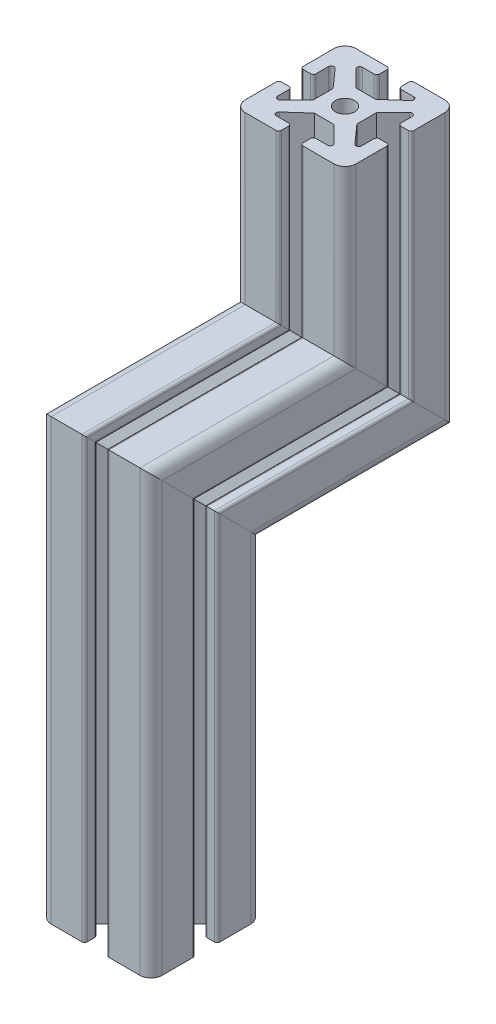
from build123d import *

# Parameters (mm, degrees)
SKETCH1_R                       = 3.492543695
F_001_40_40_EXTRUSION_1_DEPTH   = 109.284271247
SKETCH1_ON_SEGMENT_2_R          = 3.492543695
F_001_40_40_EXTRUSION_1_2_DEPTH = 128.568542495
SKETCH1_ON_SEGMENT_3_R          = 3.492543695
F_001_40_40_EXTRUSION_1_3_DEPTH = 167.884271247


with BuildPart() as part:
    # Sketch1 → 001 40-40_EXTRUSION(1) (new body)
    with BuildSketch(Plane(origin=(0, 0, 0), x_dir=(0, 0, -1), z_dir=(0, -1, 0))):
        with BuildLine():
            Line((-0.51168083, 7.684671829), (3.749889801, 7.684671829))
            Line((3.749889801, 7.684671829), (9.699681879, 13.624984685))
            ThreePointArc((9.699681879, 13.624984685), (9.917171057, 14.714970099), (8.993139054, 15.332654972))
            Line((8.993139054, 15.332654972), (4.845630957, 15.332654972))
            ThreePointArc((4.845630957, 15.332654972), (4.138524175, 15.625548191), (3.845630957, 16.332654972))
            Line((3.845630957, 16.332654972), (3.845630957, 19))
            ThreePointArc((3.845630957, 19), (4.138524175, 19.707106781), (4.845630957, 20))
            Line((4.845630957, 20), (16, 20))
            ThreePointArc((16, 20), (18.828427125, 18.828427125), (20, 16))
            Line((20, 16), (20, 4.961087436))
            ThreePointArc((20, 4.961087436), (19.707106781, 4.253980655), (19, 3.961087436))
            Line((19, 3.961087436), (16.388269628, 3.961087436))
            ThreePointArc((16.388269628, 3.961087436), (15.681162846, 4.253980655), (15.388269628, 4.961087436))
            Line((15.388269628, 4.961087436), (15.388269628, 9.408620307))
            ThreePointArc((15.388269628, 9.408620307), (14.744223919, 10.343123673), (13.641676542, 10.073901274))
            Line((13.641676542, 10.073901274), (7.684671829, 3.388818206))
            Line((7.684671829, 3.388818206), (7.684671829, 0.51168083))
            Line((7.684671829, 0.51168083), (7.684671829, -3.749889801))
            Line((7.684671829, -3.749889801), (13.624984685, -9.699681879))
            ThreePointArc((13.624984685, -9.699681879), (14.714970099, -9.917171057), (15.332654972, -8.993139054))
            Line((15.332654972, -8.993139054), (15.332654972, -4.845630957))
            ThreePointArc((15.332654972, -4.845630957), (15.625548191, -4.138524175), (16.332654972, -3.845630957))
            Line((16.332654972, -3.845630957), (19, -3.845630957))
            ThreePointArc((19, -3.845630957), (19.707106781, -4.138524175), (20, -4.845630957))
            Line((20, -4.845630957), (20, -16))
            ThreePointArc((20, -16), (18.828427125, -18.828427125), (16, -20))
            Line((16, -20), (4.961087436, -20))
            ThreePointArc((4.961087436, -20), (4.253980655, -19.707106781), (3.961087436, -19))
            Line((3.961087436, -19), (3.961087436, -16.388269628))
            ThreePointArc((3.961087436, -16.388269628), (4.253980655, -15.681162846), (4.961087436, -15.388269628))
            Line((4.961087436, -15.388269628), (9.408620307, -15.388269628))
            ThreePointArc((9.408620307, -15.388269628), (10.343123673, -14.744223919), (10.073901274, -13.641676542))
            Line((10.073901274, -13.641676542), (3.388818206, -7.684671829))
            Line((3.388818206, -7.684671829), (0.51168083, -7.684671829))
            Line((0.51168083, -7.684671829), (-3.749889801, -7.684671829))
            Line((-3.749889801, -7.684671829), (-9.699681879, -13.624984685))
            ThreePointArc((-9.699681879, -13.624984685), (-9.917171057, -14.714970099), (-8.993139054, -15.332654972))
            Line((-8.993139054, -15.332654972), (-4.845630957, -15.332654972))
            ThreePointArc((-4.845630957, -15.332654972), (-4.138524175, -15.625548191), (-3.845630957, -16.332654972))
            Line((-3.845630957, -16.332654972), (-3.845630957, -19))
            ThreePointArc((-3.845630957, -19), (-4.138524175, -19.707106781), (-4.845630957, -20))
            Line((-4.845630957, -20), (-16, -20))
            ThreePointArc((-16, -20), (-18.828427125, -18.828427125), (-20, -16))
            Line((-20, -16), (-20, -4.961087436))
            ThreePointArc((-20, -4.961087436), (-19.707106781, -4.253980655), (-19, -3.961087436))
            Line((-19, -3.961087436), (-16.388269628, -3.961087436))
            ThreePointArc((-16.388269628, -3.961087436), (-15.681162846, -4.253980655), (-15.388269628, -4.961087436))
            Line((-15.388269628, -4.961087436), (-15.388269628, -9.408620307))
            ThreePointArc((-15.388269628, -9.408620307), (-14.744223919, -10.343123673), (-13.641676542, -10.073901274))
            Line((-13.641676542, -10.073901274), (-7.684671829, -3.388818206))
            Line((-7.684671829, -3.388818206), (-7.684671829, -0.51168083))
            Line((-7.684671829, -0.51168083), (-7.684671829, 3.749889801))
            Line((-7.684671829, 3.749889801), (-13.624984685, 9.699681879))
            ThreePointArc((-13.624984685, 9.699681879), (-14.714970099, 9.917171057), (-15.332654972, 8.993139054))
            Line((-15.332654972, 8.993139054), (-15.332654972, 4.845630957))
            ThreePointArc((-15.332654972, 4.845630957), (-15.625548191, 4.138524175), (-16.332654972, 3.845630957))
            Line((-16.332654972, 3.845630957), (-19, 3.845630957))
            ThreePointArc((-19, 3.845630957), (-19.707106781, 4.138524175), (-20, 4.845630957))
            Line((-20, 4.845630957), (-20, 16))
            ThreePointArc((-20, 16), (-18.828427125, 18.828427125), (-16, 20))
            Line((-16, 20), (-4.961087436, 20))
            ThreePointArc((-4.961087436, 20), (-4.253980655, 19.707106781), (-3.961087436, 19))
            Line((-3.961087436, 19), (-3.961087436, 16.388269628))
            ThreePointArc((-3.961087436, 16.388269628), (-4.253980655, 15.681162846), (-4.961087436, 15.388269628))
            Line((-4.961087436, 15.388269628), (-9.408620307, 15.388269628))
            ThreePointArc((-9.408620307, 15.388269628), (-10.343123673, 14.744223919), (-10.073901274, 13.641676542))
            Line((-10.073901274, 13.641676542), (-3.388818206, 7.684671829))
            Line((-3.388818206, 7.684671829), (-0.51168083, 7.684671829))
        make_face()
        Circle(SKETCH1_R, mode=Mode.SUBTRACT)
    extrude(amount=F_001_40_40_EXTRUSION_1_DEPTH)

    # 001 40-40_EXTRUSION(1) mitre 1
    split(bisect_by=Plane(origin=(0, -80, 0), x_dir=(-1, 0, 0), z_dir=(0, 0.707106781, -0.707106781)), keep=Keep.TOP)


with BuildPart() as body_2:
    # Sketch1 on segment 2 (carried to segment 2) → 001 40-40_EXTRUSION_1 2 (new body)
    with BuildSketch(Plane(origin=(0, -80, -29.284271247), x_dir=(0, -1, 0), z_dir=(0, 0, 1))):
        with BuildLine():
            Line((-0.51168083, 7.684671829), (3.749889801, 7.684671829))
            Line((3.749889801, 7.684671829), (9.699681879, 13.624984685))
            ThreePointArc((9.699681879, 13.624984685), (9.917171057, 14.714970099), (8.993139054, 15.332654972))
            Line((8.993139054, 15.332654972), (4.845630957, 15.332654972))
            ThreePointArc((4.845630957, 15.332654972), (4.138524175, 15.625548191), (3.845630957, 16.332654972))
            Line((3.845630957, 16.332654972), (3.845630957, 19))
            ThreePointArc((3.845630957, 19), (4.138524175, 19.707106781), (4.845630957, 20))
            Line((4.845630957, 20), (16, 20))
            ThreePointArc((16, 20), (18.828427125, 18.828427125), (20, 16))
            Line((20, 16), (20, 4.961087436))
            ThreePointArc((20, 4.961087436), (19.707106781, 4.253980655), (19, 3.961087436))
            Line((19, 3.961087436), (16.388269628, 3.961087436))
            ThreePointArc((16.388269628, 3.961087436), (15.681162846, 4.253980655), (15.388269628, 4.961087436))
            Line((15.388269628, 4.961087436), (15.388269628, 9.408620307))
            ThreePointArc((15.388269628, 9.408620307), (14.744223919, 10.343123673), (13.641676542, 10.073901274))
            Line((13.641676542, 10.073901274), (7.684671829, 3.388818206))
            Line((7.684671829, 3.388818206), (7.684671829, 0.51168083))
            Line((7.684671829, 0.51168083), (7.684671829, -3.749889801))
            Line((7.684671829, -3.749889801), (13.624984685, -9.699681879))
            ThreePointArc((13.624984685, -9.699681879), (14.714970099, -9.917171057), (15.332654972, -8.993139054))
            Line((15.332654972, -8.993139054), (15.332654972, -4.845630957))
            ThreePointArc((15.332654972, -4.845630957), (15.625548191, -4.138524175), (16.332654972, -3.845630957))
            Line((16.332654972, -3.845630957), (19, -3.845630957))
            ThreePointArc((19, -3.845630957), (19.707106781, -4.138524175), (20, -4.845630957))
            Line((20, -4.845630957), (20, -16))
            ThreePointArc((20, -16), (18.828427125, -18.828427125), (16, -20))
            Line((16, -20), (4.961087436, -20))
            ThreePointArc((4.961087436, -20), (4.253980655, -19.707106781), (3.961087436, -19))
            Line((3.961087436, -19), (3.961087436, -16.388269628))
            ThreePointArc((3.961087436, -16.388269628), (4.253980655, -15.681162846), (4.961087436, -15.388269628))
            Line((4.961087436, -15.388269628), (9.408620307, -15.388269628))
            ThreePointArc((9.408620307, -15.388269628), (10.343123673, -14.744223919), (10.073901274, -13.641676542))
            Line((10.073901274, -13.641676542), (3.388818206, -7.684671829))
            Line((3.388818206, -7.684671829), (0.51168083, -7.684671829))
            Line((0.51168083, -7.684671829), (-3.749889801, -7.684671829))
            Line((-3.749889801, -7.684671829), (-9.699681879, -13.624984685))
            ThreePointArc((-9.699681879, -13.624984685), (-9.917171057, -14.714970099), (-8.993139054, -15.332654972))
            Line((-8.993139054, -15.332654972), (-4.845630957, -15.332654972))
            ThreePointArc((-4.845630957, -15.332654972), (-4.138524175, -15.625548191), (-3.845630957, -16.332654972))
            Line((-3.845630957, -16.332654972), (-3.845630957, -19))
            ThreePointArc((-3.845630957, -19), (-4.138524175, -19.707106781), (-4.845630957, -20))
            Line((-4.845630957, -20), (-16, -20))
            ThreePointArc((-16, -20), (-18.828427125, -18.828427125), (-20, -16))
            Line((-20, -16), (-20, -4.961087436))
            ThreePointArc((-20, -4.961087436), (-19.707106781, -4.253980655), (-19, -3.961087436))
            Line((-19, -3.961087436), (-16.388269628, -3.961087436))
            ThreePointArc((-16.388269628, -3.961087436), (-15.681162846, -4.253980655), (-15.388269628, -4.961087436))
            Line((-15.388269628, -4.961087436), (-15.388269628, -9.408620307))
            ThreePointArc((-15.388269628, -9.408620307), (-14.744223919, -10.343123673), (-13.641676542, -10.073901274))
            Line((-13.641676542, -10.073901274), (-7.684671829, -3.388818206))
            Line((-7.684671829, -3.388818206), (-7.684671829, -0.51168083))
            Line((-7.684671829, -0.51168083), (-7.684671829, 3.749889801))
            Line((-7.684671829, 3.749889801), (-13.624984685, 9.699681879))
            ThreePointArc((-13.624984685, 9.699681879), (-14.714970099, 9.917171057), (-15.332654972, 8.993139054))
            Line((-15.332654972, 8.993139054), (-15.332654972, 4.845630957))
            ThreePointArc((-15.332654972, 4.845630957), (-15.625548191, 4.138524175), (-16.332654972, 3.845630957))
            Line((-16.332654972, 3.845630957), (-19, 3.845630957))
            ThreePointArc((-19, 3.845630957), (-19.707106781, 4.138524175), (-20, 4.845630957))
            Line((-20, 4.845630957), (-20, 16))
            ThreePointArc((-20, 16), (-18.828427125, 18.828427125), (-16, 20))
            Line((-16, 20), (-4.961087436, 20))
            ThreePointArc((-4.961087436, 20), (-4.253980655, 19.707106781), (-3.961087436, 19))
            Line((-3.961087436, 19), (-3.961087436, 16.388269628))
            ThreePointArc((-3.961087436, 16.388269628), (-4.253980655, 15.681162846), (-4.961087436, 15.388269628))
            Line((-4.961087436, 15.388269628), (-9.408620307, 15.388269628))
            ThreePointArc((-9.408620307, 15.388269628), (-10.343123673, 14.744223919), (-10.073901274, 13.641676542))
            Line((-10.073901274, 13.641676542), (-3.388818206, 7.684671829))
            Line((-3.388818206, 7.684671829), (-0.51168083, 7.684671829))
        make_face()
        Circle(SKETCH1_ON_SEGMENT_2_R, mode=Mode.SUBTRACT)
    extrude(amount=F_001_40_40_EXTRUSION_1_2_DEPTH)

    # 001 40-40_EXTRUSION_1 2 mitre 1
    split(bisect_by=Plane(origin=(0, -80, 0), x_dir=(1, 0, 0), z_dir=(0, -0.707106781, 0.707106781)), keep=Keep.TOP)

    # 001 40-40_EXTRUSION_1 2 mitre 2
    split(bisect_by=Plane(origin=(0, -80, 70), x_dir=(-1, 0, 0), z_dir=(0, 0.707106781, -0.707106781)), keep=Keep.TOP)


with BuildPart() as body_3:
    # Sketch1 on segment 3 (carried to segment 3) → 001 40-40_EXTRUSION_1 3 (new body)
    with BuildSketch(Plane(origin=(0, -50.715728753, 70), x_dir=(0, 0, -1), z_dir=(0, -1, 0))):
        with BuildLine():
            Line((-0.51168083, 7.684671829), (3.749889801, 7.684671829))
            Line((3.749889801, 7.684671829), (9.699681879, 13.624984685))
            ThreePointArc((9.699681879, 13.624984685), (9.917171057, 14.714970099), (8.993139054, 15.332654972))
            Line((8.993139054, 15.332654972), (4.845630957, 15.332654972))
            ThreePointArc((4.845630957, 15.332654972), (4.138524175, 15.625548191), (3.845630957, 16.332654972))
            Line((3.845630957, 16.332654972), (3.845630957, 19))
            ThreePointArc((3.845630957, 19), (4.138524175, 19.707106781), (4.845630957, 20))
            Line((4.845630957, 20), (16, 20))
            ThreePointArc((16, 20), (18.828427125, 18.828427125), (20, 16))
            Line((20, 16), (20, 4.961087436))
            ThreePointArc((20, 4.961087436), (19.707106781, 4.253980655), (19, 3.961087436))
            Line((19, 3.961087436), (16.388269628, 3.961087436))
            ThreePointArc((16.388269628, 3.961087436), (15.681162846, 4.253980655), (15.388269628, 4.961087436))
            Line((15.388269628, 4.961087436), (15.388269628, 9.408620307))
            ThreePointArc((15.388269628, 9.408620307), (14.744223919, 10.343123673), (13.641676542, 10.073901274))
            Line((13.641676542, 10.073901274), (7.684671829, 3.388818206))
            Line((7.684671829, 3.388818206), (7.684671829, 0.51168083))
            Line((7.684671829, 0.51168083), (7.684671829, -3.749889801))
            Line((7.684671829, -3.749889801), (13.624984685, -9.699681879))
            ThreePointArc((13.624984685, -9.699681879), (14.714970099, -9.917171057), (15.332654972, -8.993139054))
            Line((15.332654972, -8.993139054), (15.332654972, -4.845630957))
            ThreePointArc((15.332654972, -4.845630957), (15.625548191, -4.138524175), (16.332654972, -3.845630957))
            Line((16.332654972, -3.845630957), (19, -3.845630957))
            ThreePointArc((19, -3.845630957), (19.707106781, -4.138524175), (20, -4.845630957))
            Line((20, -4.845630957), (20, -16))
            ThreePointArc((20, -16), (18.828427125, -18.828427125), (16, -20))
            Line((16, -20), (4.961087436, -20))
            ThreePointArc((4.961087436, -20), (4.253980655, -19.707106781), (3.961087436, -19))
            Line((3.961087436, -19), (3.961087436, -16.388269628))
            ThreePointArc((3.961087436, -16.388269628), (4.253980655, -15.681162846), (4.961087436, -15.388269628))
            Line((4.961087436, -15.388269628), (9.408620307, -15.388269628))
            ThreePointArc((9.408620307, -15.388269628), (10.343123673, -14.744223919), (10.073901274, -13.641676542))
            Line((10.073901274, -13.641676542), (3.388818206, -7.684671829))
            Line((3.388818206, -7.684671829), (0.51168083, -7.684671829))
            Line((0.51168083, -7.684671829), (-3.749889801, -7.684671829))
            Line((-3.749889801, -7.684671829), (-9.699681879, -13.624984685))
            ThreePointArc((-9.699681879, -13.624984685), (-9.917171057, -14.714970099), (-8.993139054, -15.332654972))
            Line((-8.993139054, -15.332654972), (-4.845630957, -15.332654972))
            ThreePointArc((-4.845630957, -15.332654972), (-4.138524175, -15.625548191), (-3.845630957, -16.332654972))
            Line((-3.845630957, -16.332654972), (-3.845630957, -19))
            ThreePointArc((-3.845630957, -19), (-4.138524175, -19.707106781), (-4.845630957, -20))
            Line((-4.845630957, -20), (-16, -20))
            ThreePointArc((-16, -20), (-18.828427125, -18.828427125), (-20, -16))
            Line((-20, -16), (-20, -4.961087436))
            ThreePointArc((-20, -4.961087436), (-19.707106781, -4.253980655), (-19, -3.961087436))
            Line((-19, -3.961087436), (-16.388269628, -3.961087436))
            ThreePointArc((-16.388269628, -3.961087436), (-15.681162846, -4.253980655), (-15.388269628, -4.961087436))
            Line((-15.388269628, -4.961087436), (-15.388269628, -9.408620307))
            ThreePointArc((-15.388269628, -9.408620307), (-14.744223919, -10.343123673), (-13.641676542, -10.073901274))
            Line((-13.641676542, -10.073901274), (-7.684671829, -3.388818206))
            Line((-7.684671829, -3.388818206), (-7.684671829, -0.51168083))
            Line((-7.684671829, -0.51168083), (-7.684671829, 3.749889801))
            Line((-7.684671829, 3.749889801), (-13.624984685, 9.699681879))
            ThreePointArc((-13.624984685, 9.699681879), (-14.714970099, 9.917171057), (-15.332654972, 8.993139054))
            Line((-15.332654972, 8.993139054), (-15.332654972, 4.845630957))
            ThreePointArc((-15.332654972, 4.845630957), (-15.625548191, 4.138524175), (-16.332654972, 3.845630957))
            Line((-16.332654972, 3.845630957), (-19, 3.845630957))
            ThreePointArc((-19, 3.845630957), (-19.707106781, 4.138524175), (-20, 4.845630957))
            Line((-20, 4.845630957), (-20, 16))
            ThreePointArc((-20, 16), (-18.828427125, 18.828427125), (-16, 20))
            Line((-16, 20), (-4.961087436, 20))
            ThreePointArc((-4.961087436, 20), (-4.253980655, 19.707106781), (-3.961087436, 19))
            Line((-3.961087436, 19), (-3.961087436, 16.388269628))
            ThreePointArc((-3.961087436, 16.388269628), (-4.253980655, 15.681162846), (-4.961087436, 15.388269628))
            Line((-4.961087436, 15.388269628), (-9.408620307, 15.388269628))
            ThreePointArc((-9.408620307, 15.388269628), (-10.343123673, 14.744223919), (-10.073901274, 13.641676542))
            Line((-10.073901274, 13.641676542), (-3.388818206, 7.684671829))
            Line((-3.388818206, 7.684671829), (-0.51168083, 7.684671829))
        make_face()
        Circle(SKETCH1_ON_SEGMENT_3_R, mode=Mode.SUBTRACT)
    extrude(amount=F_001_40_40_EXTRUSION_1_3_DEPTH)

    # 001 40-40_EXTRUSION_1 3 mitre 1
    split(bisect_by=Plane(origin=(0, -80, 70), x_dir=(1, 0, 0), z_dir=(0, -0.707106781, 0.707106781)), keep=Keep.TOP)


solid = Compound([part.part, body_2.part, body_3.part])
